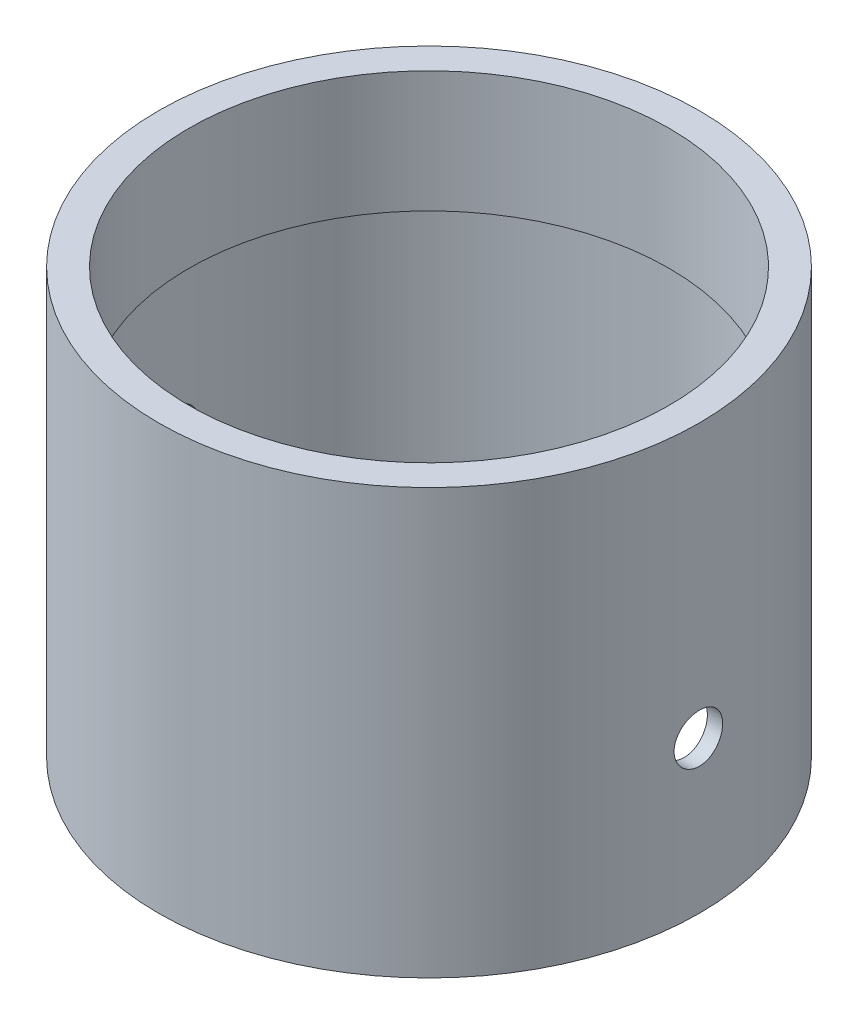
from build123d import *

# Parameters (mm, degrees)
SKETCH1_R                = 34
BOSS_EXTRUDE1_DEPTH      = 10
SKETCH2_R                = 19.7871926
SKETCH2_R_2              = 2
CUT_EXTRUDE1_DEPTH       = 10
SKETCH3_R                = 4.837531333
SKETCH4_W                = 4.837531333
SKETCH4_H                = 4.837531333
CUT_EXTRUDE3_DEPTH       = 38
CUT_EXTRUDE3_DEPTH_BACK  = 38
SKETCH5_W                = 72.361656805
SKETCH5_H                = 8.896778435
BOSS_EXTRUDE2_START      = 60
SKETCH6_R                = 22.2871926
SKETCH6_R_2              = 19.7871926
BOSS_EXTRUDE2_DEPTH      = 60
SKETCH7_R                = 21.0371926
SKETCH7_R_2              = 19.7871926
CUT_EXTRUDE4_DEPTH       = 25
CUT_EXTRUDE6_DEPTH       = 25
CUT_EXTRUDE6_DEPTH_BACK  = 25
SKETCH8_R                = 2
CUT_EXTRUDE7_DEPTH       = 43
CUT_EXTRUDE7_DEPTH_BACK  = 53
SKETCH9_W                = 69.351432881
SKETCH9_H                = 5.737807944
CUT_EXTRUDE8_START       = -25
SKETCH10_R               = 22.2871926
SKETCH10_R_2             = 21.0371926
CUT_EXTRUDE8_DEPTH       = 25
CUT_EXTRUDE9_DEPTH       = 30
CUT_EXTRUDE9_DEPTH_BACK  = 30
SKETCH11_R               = 2
CUT_EXTRUDE10_DEPTH      = 53
CUT_EXTRUDE10_DEPTH_BACK = 26
SKETCH12_W               = 42.0743852
SKETCH12_H               = 25


with BuildPart() as part:
    # Sketch1 → Boss-Extrude1 (new body)
    with BuildSketch(Plane(origin=(0, 0, 0), x_dir=(1, 0, 0), z_dir=(0, 1, 0))):
        Circle(SKETCH1_R)
    extrude(amount=BOSS_EXTRUDE1_DEPTH)

    # Sketch2 → Cut-Extrude1 (cut)
    with BuildSketch(Plane.XZ):
        Circle(SKETCH2_R)
        with Locations((-22.1, 12.5)):
            Circle(SKETCH2_R_2)
        with Locations((22.1, 12.5)):
            Circle(SKETCH2_R_2)
        with Locations((22.1, -12.5)):
            Circle(SKETCH2_R_2)
        with Locations((-22.1, -12.5)):
            Circle(SKETCH2_R_2)
    extrude(amount=-CUT_EXTRUDE1_DEPTH, mode=Mode.SUBTRACT)

    # Sketch3 → Cut-Revolve1 (revolve, cut)
    with BuildSketch(Plane(origin=(0, 0, 0), x_dir=(0, 0, -1), z_dir=(1, 0, 0))):
        with Locations((-34, 5)):
            Circle(SKETCH3_R)
    revolve(axis=Axis((0, 0, 0), (0, 1, 0)), mode=Mode.SUBTRACT)

    # Sketch4 → Cut-Revolve2 (revolve, cut)
    with BuildSketch(Plane(origin=(0, 0, 0), x_dir=(0, 0, -1), z_dir=(1, 0, 0))):
        with Locations((-31.581234333, 2.581234333)):
            Rectangle(SKETCH4_W, SKETCH4_H)
    revolve(axis=Axis((0, 0, 0), (0, 1, 0)), mode=Mode.SUBTRACT)

    # Sketch5 → Cut-Extrude3 (cut, two sides: drawn at the far end of the back side and taken through both)
    with BuildSketch(Plane(origin=(0, 0, 0), x_dir=(0, 0, -1), z_dir=(1, 0, 0)).offset(-CUT_EXTRUDE3_DEPTH_BACK)):
        with Locations((-0.901301775, 0.551610782)):
            Rectangle(SKETCH5_W, SKETCH5_H)
    extrude(amount=CUT_EXTRUDE3_DEPTH + CUT_EXTRUDE3_DEPTH_BACK, mode=Mode.SUBTRACT)

    # Sketch6 → Boss-Extrude2 (add)
    with BuildSketch(Plane.XZ.offset(-5).offset(BOSS_EXTRUDE2_START)):
        Circle(SKETCH6_R)
        Circle(SKETCH6_R_2, mode=Mode.SUBTRACT)
    extrude(amount=-BOSS_EXTRUDE2_DEPTH)

    # Sketch7 → Cut-Extrude4 (cut)
    with BuildSketch(Plane.XZ.offset(55)):
        Circle(SKETCH7_R)
        Circle(SKETCH7_R_2, mode=Mode.SUBTRACT)
    extrude(amount=-CUT_EXTRUDE4_DEPTH, mode=Mode.SUBTRACT)

    # Sketch8 → Cut-Extrude6 (cut, two sides: drawn at the far end of the back side and taken through both)
    with BuildSketch(Plane(origin=(0, 0, 0), x_dir=(0, 0, -1), z_dir=(1, 0, 0)).offset(-CUT_EXTRUDE6_DEPTH_BACK)):
        with Locations((0, -42.5)):
            Circle(SKETCH8_R)
    extrude(amount=CUT_EXTRUDE6_DEPTH + CUT_EXTRUDE6_DEPTH_BACK, mode=Mode.SUBTRACT)

    # Sketch9 → Cut-Extrude7 (cut, two sides: drawn at the far end of the back side and taken through both)
    with BuildSketch(Plane(origin=(0, 0, 0), x_dir=(0, 0, -1), z_dir=(1, 0, 0)).offset(-CUT_EXTRUDE7_DEPTH_BACK)):
        with Locations((0.165912519, 7.868903972)):
            Rectangle(SKETCH9_W, SKETCH9_H)
    extrude(amount=CUT_EXTRUDE7_DEPTH + CUT_EXTRUDE7_DEPTH_BACK, mode=Mode.SUBTRACT)

    # Sketch10 → Cut-Extrude8 (cut)
    with BuildSketch(Plane(origin=(0, 5, 0), x_dir=(1, 0, 0), z_dir=(0, 1, 0)).offset(CUT_EXTRUDE8_START)):
        Circle(SKETCH10_R)
        Circle(SKETCH10_R_2, mode=Mode.SUBTRACT)
    extrude(amount=CUT_EXTRUDE8_DEPTH, mode=Mode.SUBTRACT)

    # Sketch11 → Cut-Extrude9 (cut, two sides: drawn at the far end of the back side and taken through both)
    with BuildSketch(Plane(origin=(0, 0, 0), x_dir=(0, 0, -1), z_dir=(1, 0, 0)).offset(-CUT_EXTRUDE9_DEPTH_BACK)):
        with Locations((0, -7.5)):
            Circle(SKETCH11_R)
    extrude(amount=CUT_EXTRUDE9_DEPTH + CUT_EXTRUDE9_DEPTH_BACK, mode=Mode.SUBTRACT)

    # Sketch12 → Cut-Extrude10 (cut, two sides: drawn at the far end of the back side and taken through both)
    with BuildSketch(Plane.XY.offset(-CUT_EXTRUDE10_DEPTH_BACK)):
        with Locations((0, -7.5)):
            Rectangle(SKETCH12_W, SKETCH12_H)
    extrude(amount=CUT_EXTRUDE10_DEPTH + CUT_EXTRUDE10_DEPTH_BACK, mode=Mode.SUBTRACT)


solid = part.part
